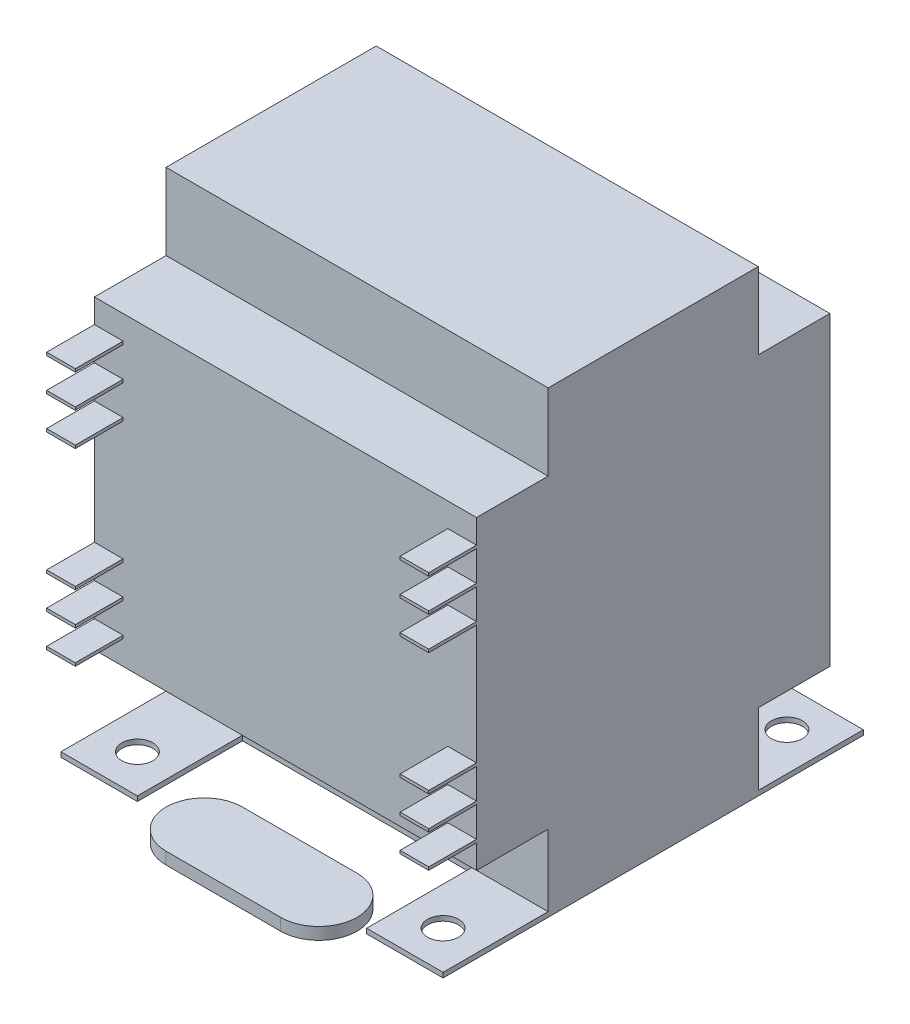
from build123d import *

# Parameters (mm, degrees)
SKETCH1_W           = 63.5
SKETCH1_H           = 76.2
BOSS_EXTRUDE1_DEPTH = 17.4625
SKETCH2_W           = 63.5
SKETCH2_H           = 50.8
BOSS_EXTRUDE2_DEPTH = 29.36875
SKETCH3_W           = 12.7
SKETCH3_H           = 17.4625
SKETCH3_R           = 2.5796875
BOSS_EXTRUDE3_DEPTH = 0.8128
SKETCH4_W           = 4.7625
SKETCH4_H           = 0.508
BOSS_EXTRUDE4_DEPTH = 7.9375
BOSS_EXTRUDE5_DEPTH = 2


with BuildPart() as part:
    # Sketch1 → Boss-Extrude1 (new, symmetric)
    with BuildSketch(Plane.XY):
        with Locations((31.75, 38.1)):
            Rectangle(SKETCH1_W, SKETCH1_H)
    extrude(amount=BOSS_EXTRUDE1_DEPTH, both=True)

    # Sketch2 → Boss-Extrude2 (add, symmetric)
    with BuildSketch(Plane.XY):
        with Locations((31.75, 38.1)):
            Rectangle(SKETCH2_W, SKETCH2_H)
    extrude(amount=BOSS_EXTRUDE2_DEPTH, both=True)

    # Sketch3 → Boss-Extrude3 (add)
    # profile 1 of 4: a face of its own
    with BuildSketch(Plane.XZ):
        with Locations((57.15, 26.19375)):
            Rectangle(SKETCH3_W, SKETCH3_H)
        with Locations(Location((57.15, 28.575, 0), (0, 0, 270))):
            Circle(SKETCH3_R, mode=Mode.SUBTRACT)
    # profile 2 of 4: a face of its own
    with BuildSketch(Plane.XZ):
        with Locations((57.15, -26.19375)):
            Rectangle(SKETCH3_W, SKETCH3_H)
        with Locations(Location((57.15, -28.575, 0), (0, 0, 270))):
            Circle(SKETCH3_R, mode=Mode.SUBTRACT)
    # profile 3 of 4: a face of its own
    with BuildSketch(Plane.XZ):
        with Locations((6.35, -26.19375)):
            Rectangle(SKETCH3_W, SKETCH3_H)
        with Locations(Location((6.35, -28.575, 0), (0, 0, 270))):
            Circle(SKETCH3_R, mode=Mode.SUBTRACT)
    # profile 4 of 4: a face of its own
    with BuildSketch(Plane.XZ):
        with Locations((6.35, 26.19375)):
            Rectangle(SKETCH3_W, SKETCH3_H)
        with Locations(Location((6.35, 28.575, 0), (0, 0, 270))):
            Circle(SKETCH3_R, mode=Mode.SUBTRACT)
    extrude(amount=-BOSS_EXTRUDE3_DEPTH)

    # Sketch4 → Boss-Extrude4 (add)
    with BuildSketch(Plane.XY.offset(29.36875)):
        with Locations((2.38125, 59.266675133)):
            Rectangle(SKETCH4_W, SKETCH4_H)
        with Locations((2.38125, 53.767575133)):
            Rectangle(SKETCH4_W, SKETCH4_H)
        with Locations((2.38125, 48.268475133)):
            Rectangle(SKETCH4_W, SKETCH4_H)
        with Locations((61.11875, 48.268475133)):
            Rectangle(SKETCH4_W, SKETCH4_H)
        with Locations((61.11875, 53.767575133)):
            Rectangle(SKETCH4_W, SKETCH4_H)
        with Locations((61.11875, 59.266675133)):
            Rectangle(SKETCH4_W, SKETCH4_H)
        with Locations((61.11875, 16.933324867)):
            Rectangle(SKETCH4_W, SKETCH4_H)
        with Locations((61.11875, 22.432424867)):
            Rectangle(SKETCH4_W, SKETCH4_H)
        with Locations((61.11875, 27.931524867)):
            Rectangle(SKETCH4_W, SKETCH4_H)
        with Locations((2.38125, 27.931524867)):
            Rectangle(SKETCH4_W, SKETCH4_H)
        with Locations((2.38125, 22.432424867)):
            Rectangle(SKETCH4_W, SKETCH4_H)
        with Locations((2.38125, 16.933324867)):
            Rectangle(SKETCH4_W, SKETCH4_H)
    extrude(amount=BOSS_EXTRUDE4_DEPTH)


with BuildPart() as body_2:
    # Sketch5 → Boss-Extrude5 (new body)
    with BuildSketch(Plane(origin=(0, 0, 0), x_dir=(-1, 0, 0), z_dir=(0, -1, 0))):
        with BuildLine():
            Line((-41.275, -39.6875), (-22.225, -39.6875))
            ThreePointArc((-22.225, -39.6875), (-15.875, -33.3375), (-22.225, -26.9875))
            Line((-22.225, -26.9875), (-41.275, -26.9875))
            ThreePointArc((-41.275, -26.9875), (-47.625, -33.3375), (-41.275, -39.6875))
        make_face()
    extrude(amount=BOSS_EXTRUDE5_DEPTH)


solid = Compound([part.part, body_2.part])
